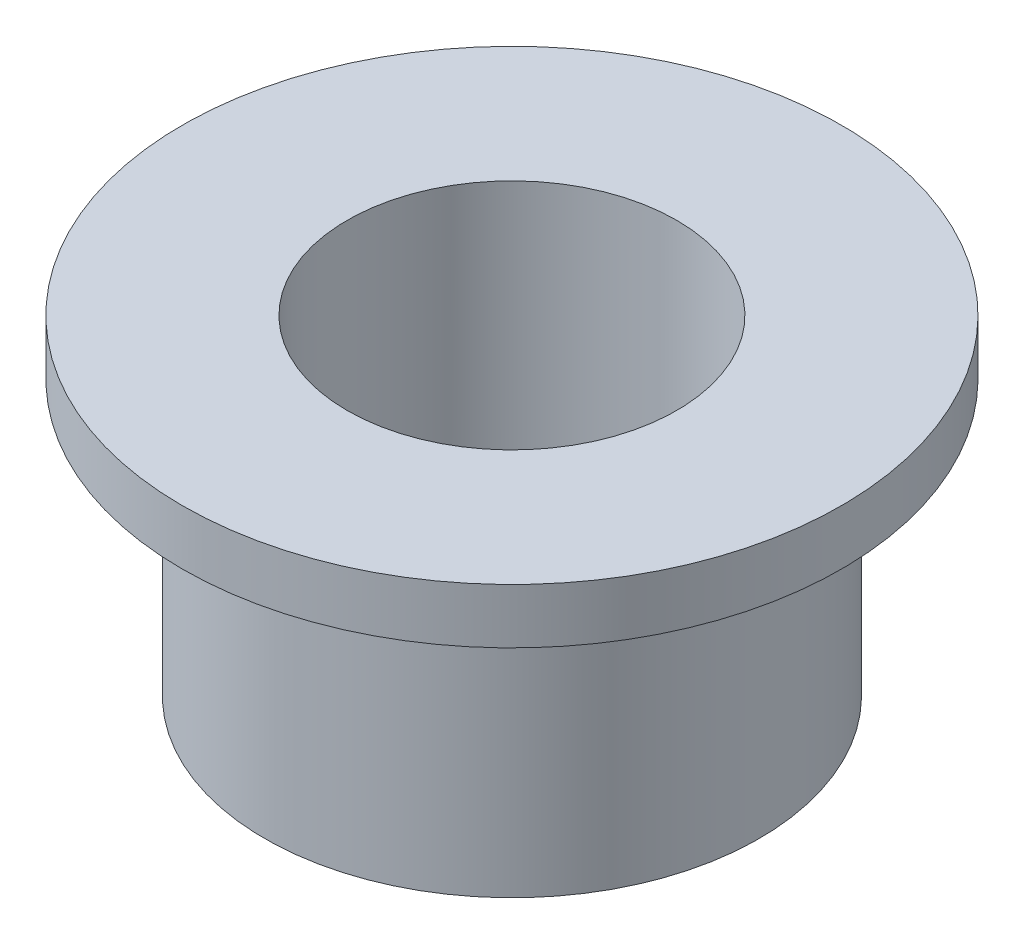
from build123d import *

# Parameters (mm, degrees)
SKETCH_1_R      = 6
SKETCH_1_R_2    = 3
EXTRUDE_1_DEPTH = 1
EXTRUDE_START   = 5
SKETCH_2_R      = 4.5
SKETCH_2_R_2    = 3
EXTRUDE_2_DEPTH = 5


with BuildPart() as part:
    # 草图1 → 凸台-拉伸1 (new body)
    with BuildSketch(Plane(origin=(0, 0, 0), x_dir=(1, 0, 0), z_dir=(0, 1, 0))):
        Circle(SKETCH_1_R)
        Circle(SKETCH_1_R_2, mode=Mode.SUBTRACT)
    extrude(amount=EXTRUDE_1_DEPTH)

    # 草图2 → 凸台-拉伸2 (add)
    with BuildSketch(Plane.XZ.offset(EXTRUDE_START)):
        Circle(SKETCH_2_R)
        Circle(SKETCH_2_R_2, mode=Mode.SUBTRACT)
    extrude(amount=-EXTRUDE_2_DEPTH)


solid = part.part
